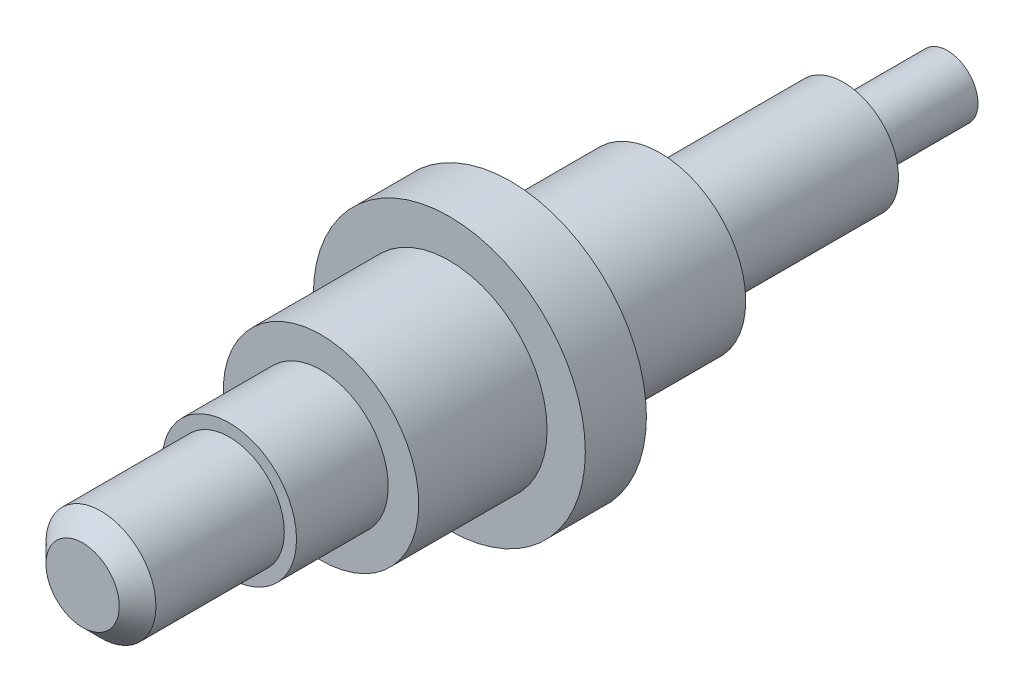
from build123d import *

# Parameters (mm, degrees)
SKETCH1_W     = 24
SKETCH1_H     = 9
SKETCH1_W_2   = 17
SKETCH1_H_2   = 5
CHAMFER1_SIZE = 3


with BuildPart() as part:
    # Sketch1 → Revolve1 (revolve)
    with BuildSketch(Plane(origin=(0, 0, 0), x_dir=(0, 0, -1), z_dir=(1, 0, 0)), mode=Mode.PRIVATE) as revolve1_sk:
        with Locations((12, 4.5)):
            Rectangle(SKETCH1_W, SKETCH1_H)
        Polygon((24, 9), (24, 0), (39, 0), (39, 11), (24, 11), align=None)
        Polygon((39, 11), (39, 0), (60, 0), (60, 16), (39, 16), align=None)
        Polygon((60, 16), (60, 0), (70, 0), (70, 14), (70, 22.25), (60, 22.25), align=None)
        Polygon((70, 14), (70, 0), (94.5, 0), (94.5, 9), (94.5, 14), align=None)
        Polygon((94.5, 9), (94.5, 0), (124.5, 0), (124.5, 5), (124.5, 9), align=None)
        with Locations((133, 2.5)):
            Rectangle(SKETCH1_W_2, SKETCH1_H_2)
    revolve(revolve1_sk.sketch.rotate(Axis((0, 0, -60), (0, 0, -1)), 90), axis=Axis((0, 0, -60), (0, 0, -1)))

    # Chamfer1
    chamfer1_edges = [part.edges().sort_by_distance(p)[0] for p in [
        (-9, 0, 0),
    ]]
    chamfer(chamfer1_edges, length=CHAMFER1_SIZE)


solid = part.part
